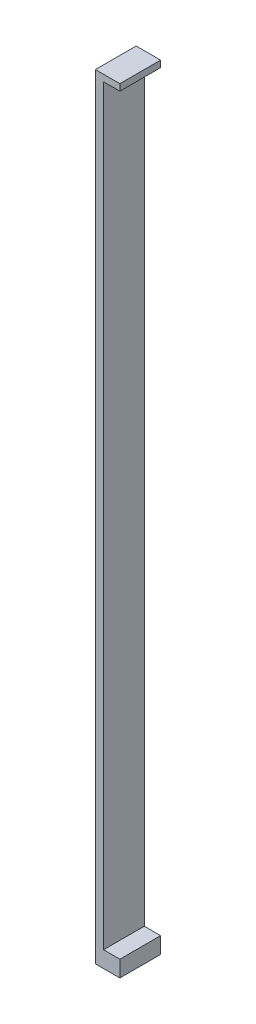
from build123d import *

# Parameters (mm, degrees)
SKETCH1_W           = 95
SKETCH1_H           = 5
BOSS_EXTRUDE1_DEPTH = 3
SKETCH2_W           = 92.2
SKETCH2_H           = 5
CUT_EXTRUDE1_DEPTH  = 2


with BuildPart() as part:
    # Sketch1 → Boss-Extrude1 (new body)
    with BuildSketch(Plane.YZ):
        with Locations((47.5, 2.5)):
            Rectangle(SKETCH1_W, SKETCH1_H)
    extrude(amount=BOSS_EXTRUDE1_DEPTH)

    # Sketch2 → Cut-Extrude1 (cut)
    with BuildSketch(Plane.YZ.offset(3)):
        with Locations((48.1, 2.5)):
            Rectangle(SKETCH2_W, SKETCH2_H)
    extrude(amount=-CUT_EXTRUDE1_DEPTH, mode=Mode.SUBTRACT)


solid = part.part
